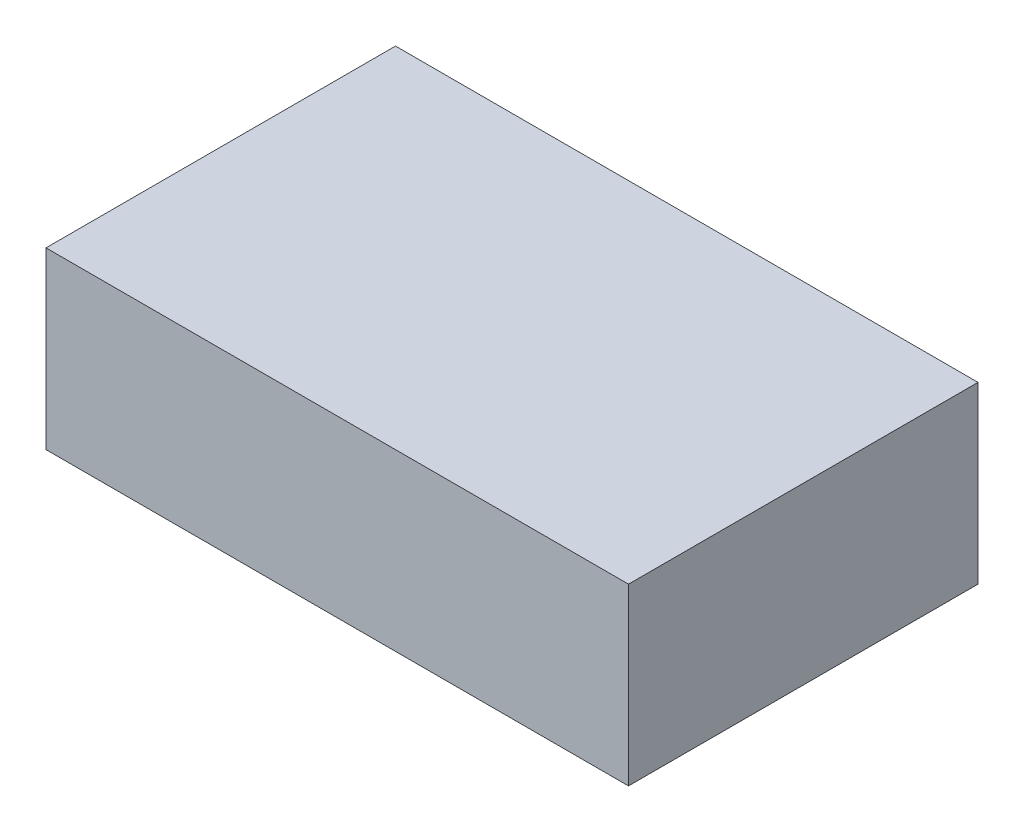
from build123d import *

# Parameters (mm, degrees)
SKETCH1_W           = 10
SKETCH1_H           = 6
BOSS_EXTRUDE1_DEPTH = 3


with BuildPart() as part:
    # Sketch1 → Boss-Extrude1 (new body)
    with BuildSketch(Plane(origin=(0, 0, 0), x_dir=(1, 0, 0), z_dir=(0, 1, 0))):
        Rectangle(SKETCH1_W, SKETCH1_H)
    extrude(amount=BOSS_EXTRUDE1_DEPTH)


solid = part.part
